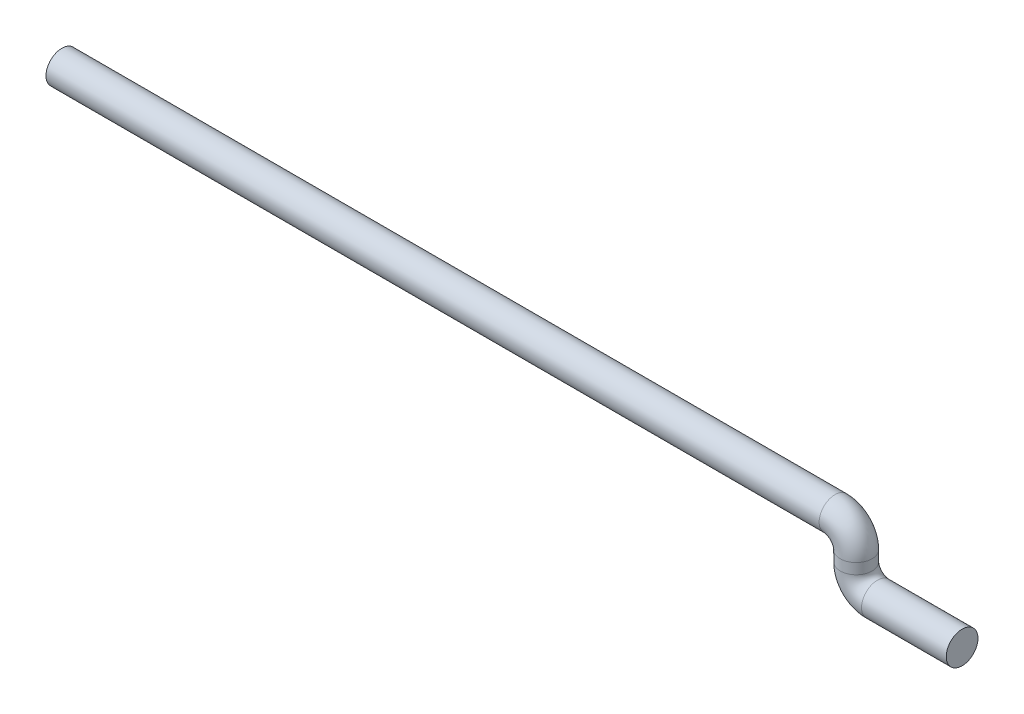
from build123d import *

# Parameters (mm, degrees)
SKETCH1_R = 0.762


with BuildPart() as part:
    # Sweep2: sweep along a path in Sketch2
    with BuildLine(Plane.XY) as sweep2_path:
        Line((0, 0), (37.084, 0))
        ThreePointArc((37.084, 0), (37.80242049, -0.29757951), (38.1, -1.016))
        Line((38.1, -1.016), (38.1, -1.524))
        ThreePointArc((38.1, -1.524), (38.39757951, -2.24242049), (39.116, -2.54))
        Line((39.116, -2.54), (43.18, -2.54))
    # Sketch1 → Sweep2 (sweep)
    with BuildSketch(Plane(origin=(0, 0, 0), x_dir=(0, 0, -1), z_dir=(1, 0, 0))):
        Circle(SKETCH1_R)
    sweep(path=sweep2_path.line)


solid = part.part
